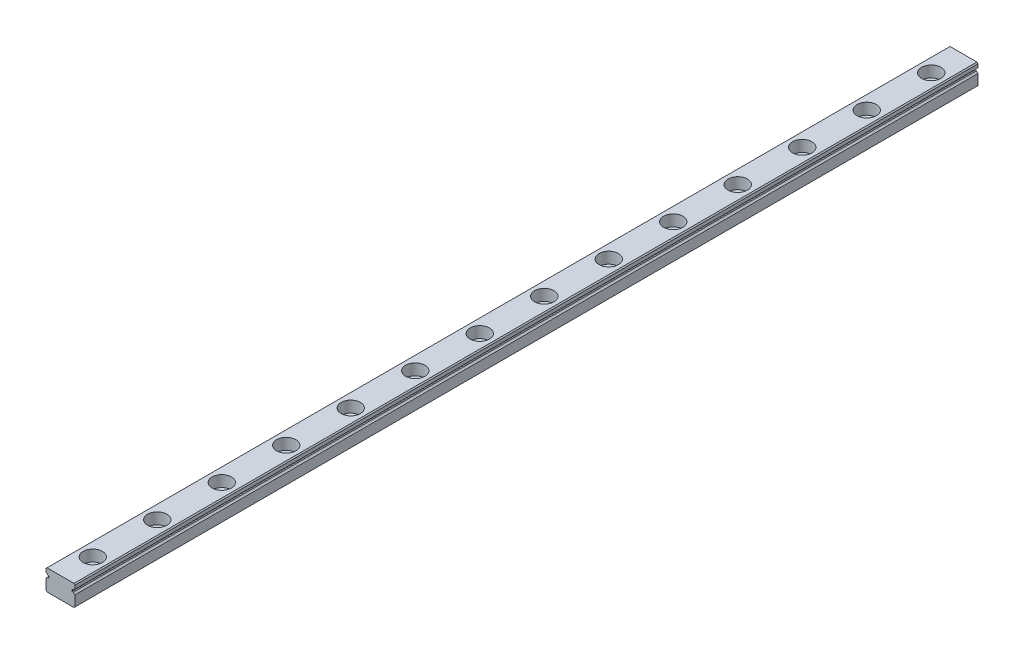
from build123d import *

# Parameters (mm, degrees)
EXTRUDE_1_DEPTH        = 280
PATTERN_LINEAR_1_COUNT = 14
PATTERN_LINEAR_1_PITCH = 20


with BuildPart() as part:
    # 草图2 → 凸台-拉伸1 (new body)
    with BuildSketch(Plane.XY):
        with BuildLine():
            Line((4.1775, 6.5), (-4.1775, 6.5))
            Line((-4.1775, 6.5), (-4.5, 6.1775))
            Line((-4.5, 6.1775), (-4.5, 5.10375))
            ThreePointArc((-4.5, 5.10375), (-4.185793433, 4.9227306), (-3.986173862, 4.62))
            Line((-3.986173862, 4.62), (-3.626173862, 4.62))
            ThreePointArc((-3.626173862, 4.62), (-3.562534251, 4.59363961), (-3.536173862, 4.53))
            Line((-3.536173862, 4.53), (-3.536173862, 4.17))
            ThreePointArc((-3.536173862, 4.17), (-3.562534251, 4.10636039), (-3.626173862, 4.08))
            Line((-3.626173862, 4.08), (-3.986173862, 4.08))
            ThreePointArc((-3.986173862, 4.08), (-4.185793433, 3.7772694), (-4.5, 3.59625))
            Line((-4.5, 3.59625), (-4.5, 0.3225))
            Line((-4.5, 0.3225), (-4.1775, 0))
            Line((-4.1775, 0), (4.1775, 0))
            Line((4.1775, 0), (4.5, 0.3225))
            Line((4.5, 0.3225), (4.5, 3.59625))
            ThreePointArc((4.5, 3.59625), (4.185793433, 3.7772694), (3.986173862, 4.08))
            Line((3.986173862, 4.08), (3.626173862, 4.08))
            ThreePointArc((3.626173862, 4.08), (3.562534251, 4.10636039), (3.536173862, 4.17))
            Line((3.536173862, 4.17), (3.536173862, 4.53))
            ThreePointArc((3.536173862, 4.53), (3.562534251, 4.59363961), (3.626173862, 4.62))
            Line((3.626173862, 4.62), (3.986173862, 4.62))
            ThreePointArc((3.986173862, 4.62), (4.185793433, 4.9227306), (4.5, 5.10375))
            Line((4.5, 5.10375), (4.5, 6.1775))
            Line((4.5, 6.1775), (4.1775, 6.5))
        make_face()
    extrude(amount=-EXTRUDE_1_DEPTH)

    # 草图3 → 切除-旋转1 (revolve, cut)
    with BuildSketch(Plane(origin=(0, 0, 0), x_dir=(0, 0, -1), z_dir=(1, 0, 0))):
        Polygon((7, 6.5), (7, 3), (8.25, 3), (8.25, 0), (10, 0), (10, 6.5), align=None)
    cut_revolve_1 = revolve(axis=Axis((0, 6.5, -10), (0, -1, 0)), mode=Mode.SUBTRACT)

    # 阵列(线性)1: 切除-旋转1 ×14
    with Locations(*[(0, 0, -i * PATTERN_LINEAR_1_PITCH) for i in range(1, PATTERN_LINEAR_1_COUNT)]):
        add(cut_revolve_1, mode=Mode.SUBTRACT)


solid = part.part
